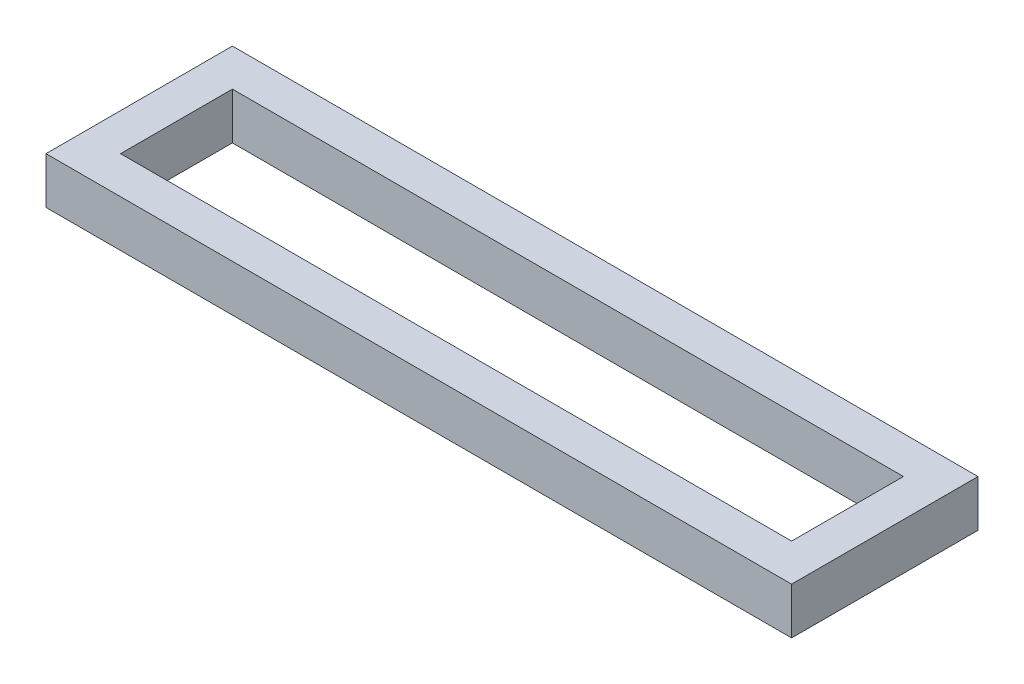
from build123d import *

# Parameters (mm, degrees)
SKETCH1_W           = 80
SKETCH1_H           = 20
SKETCH1_W_2         = 72
SKETCH1_H_2         = 12
BOSS_EXTRUDE1_DEPTH = 5


with BuildPart() as part:
    # Sketch1 → Boss-Extrude1 (new body)
    with BuildSketch(Plane(origin=(0, 0, 0), x_dir=(1, 0, 0), z_dir=(0, 1, 0))):
        with Locations((40, 10)):
            Rectangle(SKETCH1_W, SKETCH1_H)
        with Locations((40, 10)):
            Rectangle(SKETCH1_W_2, SKETCH1_H_2, mode=Mode.SUBTRACT)
    extrude(amount=BOSS_EXTRUDE1_DEPTH)


solid = part.part
